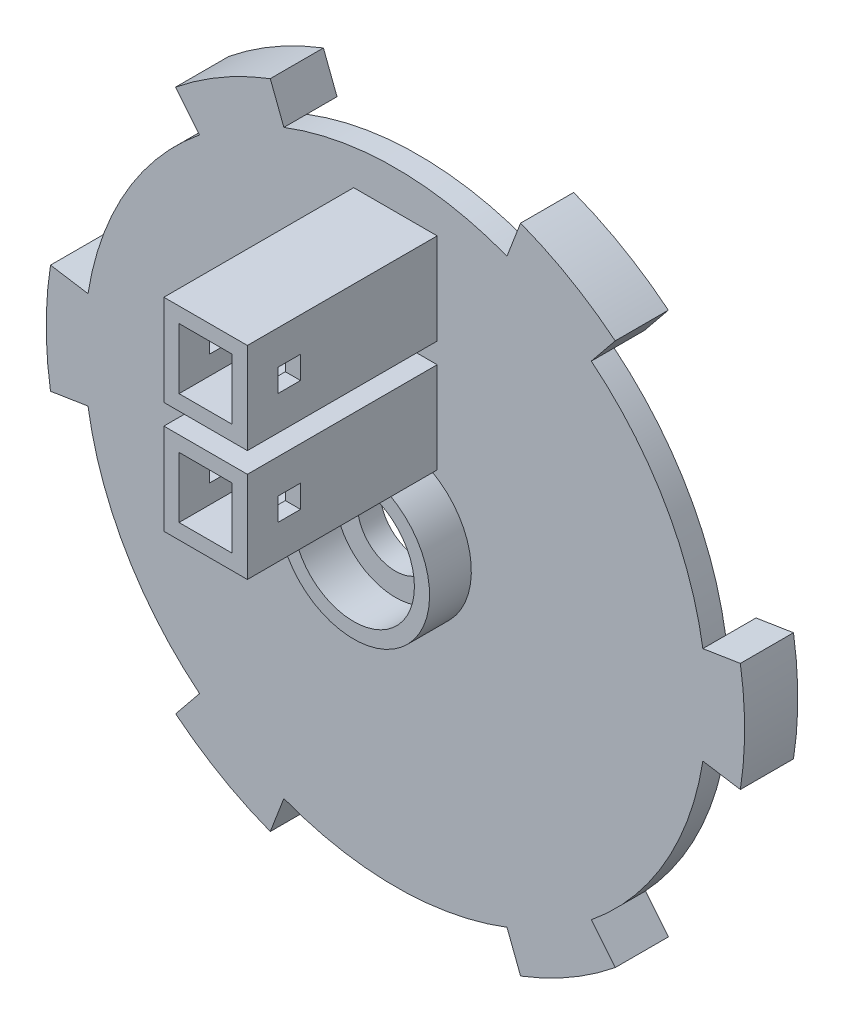
from build123d import *

# Parameters (mm, degrees)
SKETCH1_R           = 41
SKETCH1_R_2         = 5
BOSS_EXTRUDE1_DEPTH = 3
SKETCH2_W           = 11
SKETCH2_H           = 12
BOSS_EXTRUDE2_DEPTH = 25
SKETCH3_W           = 7
SKETCH3_H           = 8
CUT_EXTRUDE1_DEPTH  = 65.389440128
SKETCH4_W           = 3
SKETCH4_H           = 3
CUT_EXTRUDE2_DEPTH  = 69.023892861
BOSS_EXTRUDE3_START = -7
BOSS_EXTRUDE3_DEPTH = 7
SKETCH6_R           = 10
SKETCH6_R_2         = 8
BOSS_EXTRUDE4_DEPTH = 5.5


with BuildPart() as part:
    # Sketch1 → Boss-Extrude1 (new body)
    with BuildSketch(Plane.XY):
        Circle(SKETCH1_R)
        Circle(SKETCH1_R_2, mode=Mode.SUBTRACT)
    extrude(amount=BOSS_EXTRUDE1_DEPTH)

    # Sketch2 → Boss-Extrude2 (add)
    with BuildSketch(Plane.XY.offset(3)):
        with Locations((0, 30)):
            Rectangle(SKETCH2_W, SKETCH2_H)
        with Locations((0, 15.301408404)):
            Rectangle(SKETCH2_W, SKETCH2_H)
    extrude(amount=BOSS_EXTRUDE2_DEPTH)

    # Sketch3 → Cut-Extrude1 (cut, through all)
    with BuildSketch(Plane.XY.offset(28)):
        with Locations((0, 30)):
            Rectangle(SKETCH3_W, SKETCH3_H)
        with Locations((0, 15.301408404)):
            Rectangle(SKETCH3_W, SKETCH3_H)
    extrude(amount=-CUT_EXTRUDE1_DEPTH, mode=Mode.SUBTRACT)

    # Sketch4 → Cut-Extrude2 (cut, through all)
    with BuildSketch(Plane(origin=(5.5, 0, 0), x_dir=(0, 0, -1), z_dir=(1, 0, 0))):
        with Locations((-22.5, 15.301408404)):
            Rectangle(SKETCH4_W, SKETCH4_H)
        with Locations((-22.5, 30)):
            Rectangle(SKETCH4_W, SKETCH4_H)
    extrude(amount=-CUT_EXTRUDE2_DEPTH, mode=Mode.SUBTRACT)

    # Sketch5 → Boss-Extrude3 (add)
    with BuildSketch(Plane.XY.offset(3).offset(BOSS_EXTRUDE3_START)):
        with BuildLine():
            Line((16.484910619, 42.944660385), (14.693085931, 38.276797486))
            ThreePointArc((14.693085931, 38.276797486), (20.5, 35.507041555), (25.802136033, 31.86298442))
            Line((25.802136033, 31.86298442), (28.948711541, 35.748681567))
            ThreePointArc((28.948711541, 35.748681567), (22.999978988, 39.837132179), (16.484910619, 42.944660385))
        make_face()
        with BuildLine():
            Line((45.43362216, 7.195978818), (40.495221964, 6.413813067))
            ThreePointArc((40.495221964, 6.413813067), (41, 0), (40.495221964, -6.413813067))
            Line((40.495221964, -6.413813067), (45.43362216, -7.195978818))
            ThreePointArc((45.43362216, -7.195978818), (45.999957975, 0), (45.43362216, 7.195978818))
        make_face()
        with BuildLine():
            Line((28.948711541, -35.748681567), (25.802136033, -31.86298442))
            ThreePointArc((25.802136033, -31.86298442), (20.5, -35.507041555), (14.693085931, -38.276797486))
            Line((14.693085931, -38.276797486), (16.484910619, -42.944660385))
            ThreePointArc((16.484910619, -42.944660385), (22.999978988, -39.837132179), (28.948711541, -35.748681567))
        make_face()
        with BuildLine():
            Line((-16.484910619, -42.944660385), (-14.693085931, -38.276797486))
            ThreePointArc((-14.693085931, -38.276797486), (-20.5, -35.507041555), (-25.802136033, -31.86298442))
            Line((-25.802136033, -31.86298442), (-28.948711541, -35.748681567))
            ThreePointArc((-28.948711541, -35.748681567), (-22.999978988, -39.837132179), (-16.484910619, -42.944660385))
        make_face()
        with BuildLine():
            Line((-45.43362216, -7.195978818), (-40.495221964, -6.413813067))
            ThreePointArc((-40.495221964, -6.413813067), (-41, 0), (-40.495221964, 6.413813067))
            Line((-40.495221964, 6.413813067), (-45.43362216, 7.195978818))
            ThreePointArc((-45.43362216, 7.195978818), (-45.999957975, 0), (-45.43362216, -7.195978818))
        make_face()
        with BuildLine():
            Line((-28.948711541, 35.748681567), (-25.802136033, 31.86298442))
            ThreePointArc((-25.802136033, 31.86298442), (-20.5, 35.507041555), (-14.693085931, 38.276797486))
            Line((-14.693085931, 38.276797486), (-16.484910619, 42.944660385))
            ThreePointArc((-16.484910619, 42.944660385), (-22.999978988, 39.837132179), (-28.948711541, 35.748681567))
        make_face()
    extrude(amount=BOSS_EXTRUDE3_DEPTH)

    # Sketch6 → Boss-Extrude4 (add)
    with BuildSketch(Plane.XY.offset(3)):
        Circle(SKETCH6_R)
        Circle(SKETCH6_R_2, mode=Mode.SUBTRACT)
    extrude(amount=BOSS_EXTRUDE4_DEPTH)


solid = part.part
